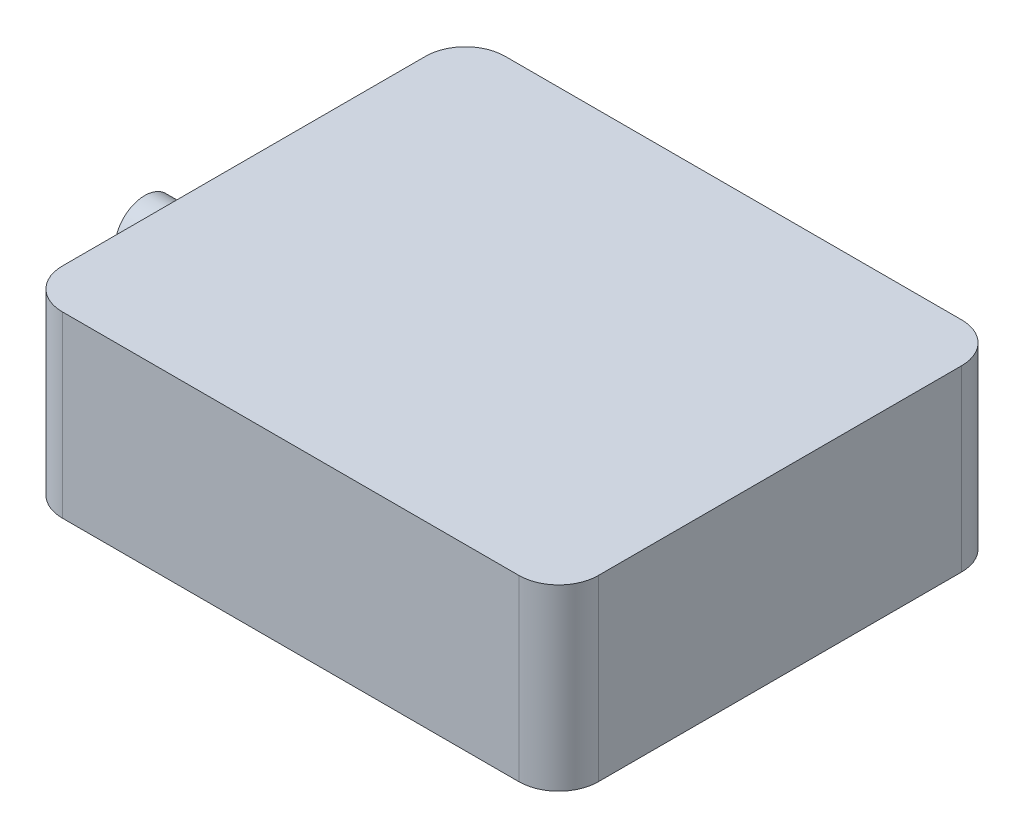
from build123d import *

# Parameters (mm, degrees)
SKETCH1_W           = 27
SKETCH1_H           = 22.3
BOSS_EXTRUDE1_DEPTH = 9
SKETCH2_R           = 1.5
BOSS_EXTRUDE3_DEPTH = 5
FILLET1_R           = 2


with BuildPart() as part:
    # Sketch1 → Boss-Extrude1 (new body)
    with BuildSketch(Plane(origin=(0, 0, 0), x_dir=(1, 0, 0), z_dir=(0, 1, 0))):
        Rectangle(SKETCH1_W, SKETCH1_H)
    extrude(amount=BOSS_EXTRUDE1_DEPTH)

    # Sketch2 → Boss-Extrude3 (add)
    with BuildSketch(Plane.ZY.offset(13.5)):
        with Locations(Location((0, 3.5, 0), (0, 0, 180))):
            Circle(SKETCH2_R)
    extrude(amount=BOSS_EXTRUDE3_DEPTH)

    # Fillet1
    fillet1_edges = [part.edges().sort_by_distance(p)[0] for p in [
        (13.5, 4.5, 11.15),
        (-13.5, 4.5, 11.15),
        (-13.5, 4.5, -11.15),
        (13.5, 4.5, -11.15),
    ]]
    fillet(fillet1_edges, radius=FILLET1_R)


solid = part.part
